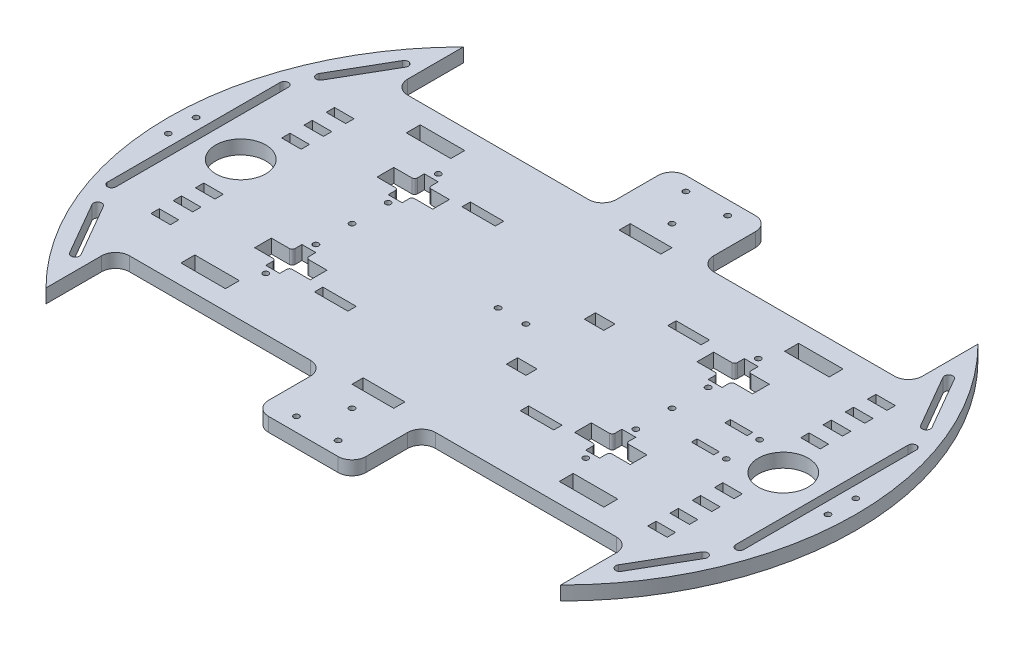
from build123d import *

# Parameters (mm, degrees)
BOSS_EXTRUDE1_DEPTH = 5
SKETCH2_R           = 9
SKETCH2_W           = 7
SKETCH2_H           = 3
CUT_EXTRUDE1_DEPTH  = 5
SKETCH2_3_W         = 15
SKETCH2_3_H         = 4
SKETCH2_3_R         = 9
SKETCH2_3_R_2       = 1
SKETCH2_3_W_2       = 7
SKETCH2_3_H_2       = 3
SKETCH2_3_W_3       = 12
CUT_EXTRUDE2_DEPTH  = 5
SKETCH5_W           = 16
SKETCH5_H           = 5
CUT_EXTRUDE3_DEPTH  = 10
SKETCH6_W           = 8
SKETCH6_H           = 2
CUT_EXTRUDE4_DEPTH  = 10


with BuildPart() as part:
    # Sketch1 → Boss-Extrude1 (new body)
    with BuildSketch(Plane(origin=(0, 0, 0), x_dir=(1, 0, 0), z_dir=(0, 1, 0))):
        with BuildLine():
            Line((-12.5, 75), (12.5, 75))
            ThreePointArc((12.5, 75), (16.035533906, 73.535533906), (17.5, 70))
            Line((17.5, 70), (17.5, 55))
            ThreePointArc((17.5, 55), (18.964466094, 51.464466094), (22.5, 50))
            Line((22.5, 50), (87.5, 50))
            ThreePointArc((87.5, 50), (91.035533906, 51.464466094), (92.5, 55))
            Line((92.5, 55), (92.5, 75))
            ThreePointArc((92.5, 75), (123.566017178, 0), (92.5, -75))
            Line((92.5, -75), (92.5, -55))
            ThreePointArc((92.5, -55), (91.035533906, -51.464466094), (87.5, -50))
            Line((87.5, -50), (22.5, -50))
            ThreePointArc((22.5, -50), (18.964466094, -51.464466094), (17.5, -55))
            Line((17.5, -55), (17.5, -70))
            ThreePointArc((17.5, -70), (16.035533906, -73.535533906), (12.5, -75))
            Line((12.5, -75), (-12.5, -75))
            ThreePointArc((-12.5, -75), (-16.035533906, -73.535533906), (-17.5, -70))
            Line((-17.5, -70), (-17.5, -55))
            ThreePointArc((-17.5, -55), (-18.964466094, -51.464466094), (-22.5, -50))
            Line((-22.5, -50), (-87.5, -50))
            ThreePointArc((-87.5, -50), (-91.035533906, -51.464466094), (-92.5, -55))
            Line((-92.5, -55), (-92.5, -75))
            ThreePointArc((-92.5, -75), (-123.566017178, 0), (-92.5, 75))
            Line((-92.5, 75), (-92.5, 55))
            ThreePointArc((-92.5, 55), (-91.035533906, 51.464466094), (-87.5, 50))
            Line((-87.5, 50), (-22.5, 50))
            ThreePointArc((-22.5, 50), (-18.964466094, 51.464466094), (-17.5, 55))
            Line((-17.5, 55), (-17.5, 70))
            ThreePointArc((-17.5, 70), (-16.035533906, 73.535533906), (-12.5, 75))
        make_face()
    extrude(amount=BOSS_EXTRUDE1_DEPTH)

    # Sketch2 → Cut-Extrude1 (cut)
    with BuildSketch(Plane(origin=(0, 5, 0), x_dir=(1, 0, 0), z_dir=(0, 1, 0))):
        with BuildLine():
            Line((-114.375052562, 31), (-114.375052562, -31))
            ThreePointArc((-114.375052562, -31), (-112.875052562, -32.5), (-111.375052562, -31))
            Line((-111.375052562, -31), (-111.375052562, 31))
            ThreePointArc((-111.375052562, 31), (-112.875052562, 32.5), (-114.375052562, 31))
        make_face()
        with Locations((-97.5, 0)):
            Circle(SKETCH2_R)
        with Locations((-93.285577646, 23.5)):
            Rectangle(SKETCH2_W, SKETCH2_H)
        with Locations((-93.285577646, 31.5)):
            Rectangle(SKETCH2_W, SKETCH2_H)
        with Locations((-93.285577646, 15.5)):
            Rectangle(SKETCH2_W, SKETCH2_H)
        with Locations((-93.285577646, -15.5)):
            Rectangle(SKETCH2_W, SKETCH2_H)
        with Locations((-93.285577646, -31.5)):
            Rectangle(SKETCH2_W, SKETCH2_H)
        with Locations((-93.285577646, -23.5)):
            Rectangle(SKETCH2_W, SKETCH2_H)
        with BuildLine():
            ThreePointArc((-54, -19), (-54.707106781, -18.707106781), (-55, -18))
            Line((-55, -18), (-55, -15.5))
            Line((-55, -15.5), (-60, -15.5))
            Line((-60, -15.5), (-60, -18))
            ThreePointArc((-60, -18), (-60.292893219, -18.707106781), (-61, -19))
            Line((-61, -19), (-67.5, -19))
            Line((-67.5, -19), (-67.5, -25))
            Line((-67.5, -25), (-61, -25))
            ThreePointArc((-61, -25), (-60.292893219, -25.292893219), (-60, -26))
            Line((-60, -26), (-60, -28.5))
            Line((-60, -28.5), (-55, -28.5))
            Line((-55, -28.5), (-55, -26))
            ThreePointArc((-55, -26), (-54.707106781, -25.292893219), (-54, -25))
            Line((-54, -25), (-47.5, -25))
            Line((-47.5, -25), (-47.5, -19))
            Line((-47.5, -19), (-54, -19))
        make_face()
        with BuildLine():
            Line((-99.164303811, 59.851596989), (-110.164303811, 40.799038106))
            ThreePointArc((-110.164303811, 40.799038106), (-109.615265705, 38.75), (-107.5662276, 39.299038106))
            Line((-107.5662276, 39.299038106), (-96.5662276, 58.351596989))
            ThreePointArc((-96.5662276, 58.351596989), (-97.115265705, 60.400635095), (-99.164303811, 59.851596989))
        make_face()
        with BuildLine():
            ThreePointArc((-107.5662276, -39.299038106), (-109.615265705, -38.75), (-110.164303811, -40.799038106))
            Line((-110.164303811, -40.799038106), (-99.164303811, -59.851596989))
            ThreePointArc((-99.164303811, -59.851596989), (-97.115265705, -60.400635095), (-96.5662276, -58.351596989))
            Line((-96.5662276, -58.351596989), (-107.5662276, -39.299038106))
        make_face()
    extrude(amount=-CUT_EXTRUDE1_DEPTH, mode=Mode.SUBTRACT)

    # Sketch2<3> → Cut-Extrude2 (cut)
    with BuildSketch(Plane(origin=(0, 5, 0), x_dir=(1, 0, 0), z_dir=(0, 1, 0))):
        with Locations((0, 48)):
            Rectangle(SKETCH2_3_W, SKETCH2_3_H)
        with BuildLine():
            Line((111.375052562, 31), (111.375052562, -31))
            ThreePointArc((111.375052562, -31), (112.875052562, -32.5), (114.375052562, -31))
            Line((114.375052562, -31), (114.375052562, 31))
            ThreePointArc((114.375052562, 31), (112.875052562, 32.5), (111.375052562, 31))
        make_face()
        with Locations((97.5, 0)):
            Circle(SKETCH2_3_R)
        with Locations((57.5, 0)):
            Circle(SKETCH2_3_R_2)
        with Locations((5, 0)):
            Circle(SKETCH2_3_R_2)
        with Locations((-5, 0)):
            Circle(SKETCH2_3_R_2)
        with Locations((-57.5, 0)):
            Circle(SKETCH2_3_R_2)
        with Locations((0, -48)):
            Rectangle(SKETCH2_3_W, SKETCH2_3_H)
        with Locations((93.285577646, 15.5)):
            Rectangle(SKETCH2_3_W_2, SKETCH2_3_H_2)
        with Locations((93.285577646, 31.5)):
            Rectangle(SKETCH2_3_W_2, SKETCH2_3_H_2)
        with Locations((93.285577646, 23.5)):
            Rectangle(SKETCH2_3_W_2, SKETCH2_3_H_2)
        with Locations((93.285577646, -23.5)):
            Rectangle(SKETCH2_3_W_2, SKETCH2_3_H_2)
        with Locations((93.285577646, -31.5)):
            Rectangle(SKETCH2_3_W_2, SKETCH2_3_H_2)
        with Locations((93.285577646, -15.5)):
            Rectangle(SKETCH2_3_W_2, SKETCH2_3_H_2)
        with Locations((93.285577646, 39.5)):
            Rectangle(SKETCH2_3_W_2, SKETCH2_3_H_2)
        with Locations((93.285577646, -39.5)):
            Rectangle(SKETCH2_3_W_2, SKETCH2_3_H_2)
        with BuildLine():
            Line((-47.5, 25), (-54, 25))
            ThreePointArc((-54, 25), (-54.707106781, 25.292893219), (-55, 26))
            Line((-55, 26), (-55, 28.5))
            Line((-55, 28.5), (-60, 28.5))
            Line((-60, 28.5), (-60, 26))
            ThreePointArc((-60, 26), (-60.292893219, 25.292893219), (-61, 25))
            Line((-61, 25), (-67.5, 25))
            Line((-67.5, 25), (-67.5, 19))
            Line((-67.5, 19), (-61, 19))
            ThreePointArc((-61, 19), (-60.292893219, 18.707106781), (-60, 18))
            Line((-60, 18), (-60, 15.5))
            Line((-60, 15.5), (-55, 15.5))
            Line((-55, 15.5), (-55, 18))
            ThreePointArc((-55, 18), (-54.707106781, 18.707106781), (-54, 19))
            Line((-54, 19), (-47.5, 19))
            Line((-47.5, 19), (-47.5, 25))
        make_face()
        with BuildLine():
            Line((47.5, -25), (54, -25))
            ThreePointArc((54, -25), (54.707106781, -25.292893219), (55, -26))
            Line((55, -26), (55, -28.5))
            Line((55, -28.5), (60, -28.5))
            Line((60, -28.5), (60, -26))
            ThreePointArc((60, -26), (60.292893219, -25.292893219), (61, -25))
            Line((61, -25), (67.5, -25))
            Line((67.5, -25), (67.5, -19))
            Line((67.5, -19), (61, -19))
            ThreePointArc((61, -19), (60.292893219, -18.707106781), (60, -18))
            Line((60, -18), (60, -15.5))
            Line((60, -15.5), (55, -15.5))
            Line((55, -15.5), (55, -18))
            ThreePointArc((55, -18), (54.707106781, -18.707106781), (54, -19))
            Line((54, -19), (47.5, -19))
            Line((47.5, -19), (47.5, -25))
        make_face()
        with BuildLine():
            ThreePointArc((54, 19), (54.707106781, 18.707106781), (55, 18))
            Line((55, 18), (55, 15.5))
            Line((55, 15.5), (60, 15.5))
            Line((60, 15.5), (60, 18))
            ThreePointArc((60, 18), (60.292893219, 18.707106781), (61, 19))
            Line((61, 19), (67.5, 19))
            Line((67.5, 19), (67.5, 25))
            Line((67.5, 25), (61, 25))
            ThreePointArc((61, 25), (60.292893219, 25.292893219), (60, 26))
            Line((60, 26), (60, 28.5))
            Line((60, 28.5), (55, 28.5))
            Line((55, 28.5), (55, 26))
            ThreePointArc((55, 26), (54.707106781, 25.292893219), (54, 25))
            Line((54, 25), (47.5, 25))
            Line((47.5, 25), (47.5, 19))
            Line((47.5, 19), (54, 19))
        make_face()
        with Locations((-36.986676368, -26.5)):
            Rectangle(SKETCH2_3_W_3, SKETCH2_3_H_2)
        with Locations((-36.986676368, 26.5)):
            Rectangle(SKETCH2_3_W_3, SKETCH2_3_H_2)
        with Locations((36.986676368, 26.5)):
            Rectangle(SKETCH2_3_W_3, SKETCH2_3_H_2)
        with Locations((36.986676368, -26.5)):
            Rectangle(SKETCH2_3_W_3, SKETCH2_3_H_2)
        with Locations((17.5, 14)):
            Rectangle(SKETCH2_3_W_2, SKETCH2_3_H)
        with Locations((17.5, -14)):
            Rectangle(SKETCH2_3_W_2, SKETCH2_3_H)
        with BuildLine():
            ThreePointArc((107.5662276, 39.299038106), (109.615265705, 38.75), (110.164303811, 40.799038106))
            Line((110.164303811, 40.799038106), (99.164303811, 59.851596989))
            ThreePointArc((99.164303811, 59.851596989), (97.115265705, 60.400635095), (96.5662276, 58.351596989))
            Line((96.5662276, 58.351596989), (107.5662276, 39.299038106))
        make_face()
        with BuildLine():
            Line((99.164303811, -59.851596989), (110.164303811, -40.799038106))
            ThreePointArc((110.164303811, -40.799038106), (109.615265705, -38.75), (107.5662276, -39.299038106))
            Line((107.5662276, -39.299038106), (96.5662276, -58.351596989))
            ThreePointArc((96.5662276, -58.351596989), (97.115265705, -60.400635095), (99.164303811, -59.851596989))
        make_face()
        with Locations((0, 57.5)):
            Circle(SKETCH2_3_R_2)
        with Locations((-7.5, 70)):
            Circle(SKETCH2_3_R_2)
        with Locations((7.5, 70)):
            Circle(SKETCH2_3_R_2)
        with Locations((7.5, -70)):
            Circle(SKETCH2_3_R_2)
        with Locations((-7.5, -70)):
            Circle(SKETCH2_3_R_2)
        with Locations((0, -57.5)):
            Circle(SKETCH2_3_R_2)
        with Locations((-118.566017178, 5)):
            Circle(SKETCH2_3_R_2)
        with Locations((-118.566017178, -5)):
            Circle(SKETCH2_3_R_2)
        with Locations((118.566017178, -5)):
            Circle(SKETCH2_3_R_2)
        with Locations((118.566017178, 5)):
            Circle(SKETCH2_3_R_2)
        with Locations((83.020340057, 6)):
            Circle(SKETCH2_3_R_2)
        with Locations((83.020340057, -6)):
            Circle(SKETCH2_3_R_2)
        with Locations((57.5, 13)):
            Circle(SKETCH2_3_R_2)
        with Locations((57.5, -13)):
            Circle(SKETCH2_3_R_2)
        with Locations((57.5, 31)):
            Circle(SKETCH2_3_R_2)
        with Locations((57.5, -31)):
            Circle(SKETCH2_3_R_2)
        with Locations((-57.5, -31)):
            Circle(SKETCH2_3_R_2)
        with Locations((-57.5, -13)):
            Circle(SKETCH2_3_R_2)
        with Locations((-57.5, 13)):
            Circle(SKETCH2_3_R_2)
        with Locations((-57.5, 31)):
            Circle(SKETCH2_3_R_2)
    extrude(amount=-CUT_EXTRUDE2_DEPTH, mode=Mode.SUBTRACT)

    # Sketch5 → Cut-Extrude3 (cut)
    with BuildSketch(Plane(origin=(0, 5, 0), x_dir=(1, 0, 0), z_dir=(0, 1, 0))):
        with Locations((68, 40.5)):
            Rectangle(SKETCH5_W, SKETCH5_H)
        with Locations((68, -40.5)):
            Rectangle(SKETCH5_W, SKETCH5_H)
        with Locations((-68, -40.5)):
            Rectangle(SKETCH5_W, SKETCH5_H)
        with Locations((-68, 40.5)):
            Rectangle(SKETCH5_W, SKETCH5_H)
    extrude(amount=-CUT_EXTRUDE3_DEPTH, mode=Mode.SUBTRACT)

    # Sketch6 → Cut-Extrude4 (cut)
    with BuildSketch(Plane(origin=(0, 5, 0), x_dir=(1, 0, 0), z_dir=(0, 1, 0))):
        with Locations((75.501022886, -6)):
            Rectangle(SKETCH6_W, SKETCH6_H)
        with Locations((75.501022886, 6)):
            Rectangle(SKETCH6_W, SKETCH6_H)
    extrude(amount=-CUT_EXTRUDE4_DEPTH, mode=Mode.SUBTRACT)


solid = part.part
